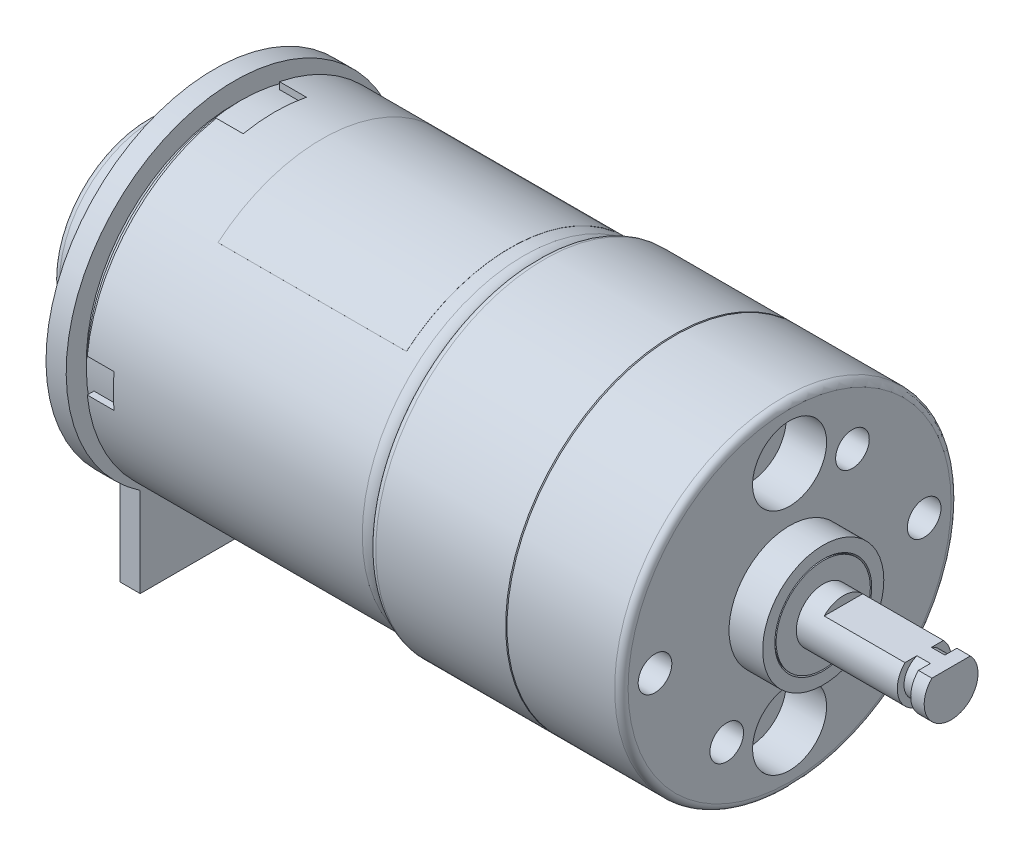
from build123d import *

# Parameters (mm, degrees)
ESQUISSE3_W                = 4.7
ESQUISSE3_H                = 3
ESQUISSE3_W_2              = 3
ESQUISSE3_H_2              = 2.5
ENL_V_MAT_EXTRU_1_DEPTH    = 2
CHANFREIN1_SIZE            = 0.5
ESQUISSE5_R                = 1.25
BOSS_EXTRU_1_DEPTH         = 1.5
BOSS_EXTRU_2_START         = 10.25
ESQUISSE6_R                = 12.5
BOSS_EXTRU_2_DEPTH         = 10.25
CONG_2_R                   = 0.5
CHANFREIN2_SIZE            = 0.1
BOSS_EXTRU_3_START         = 8.5
ESQUISSE7_R                = 12.5
BOSS_EXTRU_3_DEPTH         = 8.5
CONG_3_R                   = 0.5
ESQUISSE8_R                = 4.5
ESQUISSE8_R_2              = 3.5
BOSS_EXTRU_4_DEPTH         = 2.5
CHANFREIN3_SIZE            = 0.1
ESQUISSE10_R               = 3.5
ESQUISSE10_R_2             = 2
BOSS_EXTRU_6_DEPTH         = 2.5
ESQUISSE13_W               = 11.559263521
ESQUISSE13_H               = 4.088991178
ENL_V_MAT_EXTRU_2_DEPTH    = 8
ESQUISSE14_R               = 1
BOSS_EXTRU_8_DEPTH         = 7.5
ESQUISSE16_R               = 7
ESQUISSE16_R_2             = 3.5
BOSS_EXTRU_9_DEPTH         = 4
CONG_4_R                   = 0.5
BOSS_EXTRU_10_DEPTH        = 0.1
BOSS_EXTRU_10_DEPTH_BACK   = 4.1
ESQUISSE17_R               = 3.5
ESQUISSE17_R_2             = 1.005
ESQUISSE18_R               = 2.75
ENL_V_MAT_EXTRU_3_DEPTH    = 3
TROU_TARAUD_M32_AT_2_COUNT = 2
TROU_TARAUD_M32_AT_2_PITCH = 17
BOSS_EXTRU_11_START        = -14
BOSS_EXTRU_11_DEPTH        = 14


with BuildPart() as part:
    # Esquisse1 → Révol.-Mince3 (revolve)
    with BuildSketch(Plane.XY, mode=Mode.PRIVATE) as r_vol_mince3_sk:
        with BuildLine():
            Line((0, 0), (0, -11))
            ThreePointArc((0, -11), (-0.292893219, -11.707106781), (-1, -12))
            Line((-1, -12), (-21.5, -12))
            Line((-21.5, -12), (-21.5, -11.5))
            Line((-21.5, -11.5), (-1, -11.5))
            ThreePointArc((-1, -11.5), (-0.646446609, -11.353553391), (-0.5, -11))
            Line((-0.5, -11), (-0.5, 0))
            Line((-0.5, 0), (0, 0))
        make_face()
    revolve(r_vol_mince3_sk.sketch.rotate(Axis((-41.566699443, 0, 0), (1, 0, 0)), 270), axis=Axis((-41.566699443, 0, 0), (1, 0, 0)))

    # Esquisse3 → Enlèv. mat.-Extru.1 (cut)
    with BuildSketch(Plane.ZY.offset(21.5)):
        with Locations((0, -11.5)):
            Rectangle(ESQUISSE3_W, ESQUISSE3_H)
        with Locations((0, 11.5)):
            Rectangle(ESQUISSE3_W, ESQUISSE3_H)
        with Locations((11.5, 0)):
            Rectangle(ESQUISSE3_W_2, ESQUISSE3_H_2)
        with Locations((-11.5, 0)):
            Rectangle(ESQUISSE3_W_2, ESQUISSE3_H_2)
    extrude(amount=-ENL_V_MAT_EXTRU_1_DEPTH, mode=Mode.SUBTRACT)

    # Esquisse4 → Révolution2 (revolve)
    with BuildSketch(Plane.XY, mode=Mode.PRIVATE) as r_volution2_sk:
        with BuildLine():
            Line((-0.5, 11), (-0.5, 0))
            Line((-0.5, 0), (-22.5, 0))
            Line((-22.5, 0), (-22.5, 11.5))
            Line((-22.5, 11.5), (-1, 11.5))
            ThreePointArc((-1, 11.5), (-0.646446609, 11.353553391), (-0.5, 11))
        make_face()
    revolve(r_volution2_sk.sketch.rotate(Axis((-25.268401873, 0, 0), (1, 0, 0)), 90), axis=Axis((-25.268401873, 0, 0), (1, 0, 0)))

    # Chanfrein1
    chanfrein1_edges = [part.edges().sort_by_distance(p)[0] for p in [
        (-22.5, 0, -11.5),
    ]]
    chamfer(chanfrein1_edges, length=CHANFREIN1_SIZE)

    # Esquisse5 → Boss.-Extru.1 (add)
    with BuildSketch(Plane.ZY.offset(22.5)):
        with BuildLine():
            Line((-7, -10.356157589), (-7, -17))
            Line((-7, -17), (7, -17))
            Line((7, -17), (7, -10.356157589))
            ThreePointArc((7, -10.356157589), (0, 12.5), (-7, -10.356157589))
        make_face()
        Circle(ESQUISSE5_R, mode=Mode.SUBTRACT)
    extrude(amount=BOSS_EXTRU_1_DEPTH)

    # Esquisse6 → Boss.-Extru.2 (add)
    with BuildSketch(Plane(origin=(0, 0, 0), x_dir=(0, 0, -1), z_dir=(1, 0, 0)).offset(BOSS_EXTRU_2_START)):
        Circle(ESQUISSE6_R)
    extrude(amount=-BOSS_EXTRU_2_DEPTH)

    # Congé2
    cong_2_edges = [part.edges().sort_by_distance(p)[0] for p in [
        (0, 0, 12.5),
    ]]
    fillet(cong_2_edges, radius=CONG_2_R)

    # Chanfrein2
    chanfrein2_edges = [part.edges().sort_by_distance(p)[0] for p in [
        (10.25, 0, 12.5),
    ]]
    chamfer(chanfrein2_edges, length=CHANFREIN2_SIZE)

    # Esquisse7 → Boss.-Extru.3 (add)
    with BuildSketch(Plane(origin=(10.25, 0, 0), x_dir=(0, 0, -1), z_dir=(1, 0, 0)).offset(BOSS_EXTRU_3_START)):
        Circle(ESQUISSE7_R)
    extrude(amount=-BOSS_EXTRU_3_DEPTH)

    # Congé3
    cong_3_edges = [part.edges().sort_by_distance(p)[0] for p in [
        (18.75, 0, 12.5),
    ]]
    fillet(cong_3_edges, radius=CONG_3_R)

    # Esquisse8 → Boss.-Extru.4 (add)
    with BuildSketch(Plane(origin=(18.75, 0, 0), x_dir=(0, 0, -1), z_dir=(1, 0, 0))):
        Circle(ESQUISSE8_R)
        Circle(ESQUISSE8_R_2, mode=Mode.SUBTRACT)
    extrude(amount=BOSS_EXTRU_4_DEPTH)

    # Chanfrein3
    chanfrein3_edges = [part.edges().sort_by_distance(p)[0] for p in [
        (21.25, 0, 3.5),
    ]]
    chamfer(chanfrein3_edges, length=CHANFREIN3_SIZE)

    # Esquisse10 → Boss.-Extru.6 (add)
    with BuildSketch(Plane(origin=(18.75, 0, 0), x_dir=(0, 0, -1), z_dir=(1, 0, 0))):
        Circle(ESQUISSE10_R)
        Circle(ESQUISSE10_R_2, mode=Mode.SUBTRACT)
    extrude(amount=BOSS_EXTRU_6_DEPTH)

    # Esquisse12 → Révolution3 (revolve)
    with BuildSketch(Plane.XY, mode=Mode.PRIVATE) as r_volution3_sk:
        Polygon((18.75, -2), (28.75, -2), (28.75, -1.5), (29.75, -1.5), (29.75, -2), (30.75, -2), (30.75, 0), (18.75, 0), align=None)
    revolve(r_volution3_sk.sketch.rotate(Axis((-4.872202699, 0, 0), (1, 0, 0)), 270), axis=Axis((-4.872202699, 0, 0), (1, 0, 0)))

    # Esquisse13 → Enlèv. mat.-Extru.2 (cut)
    with BuildSketch(Plane(origin=(30.75, 0, 0), x_dir=(0, 0, -1), z_dir=(1, 0, 0))):
        with Locations((0.530782509, 3.444495589)):
            Rectangle(ESQUISSE13_W, ESQUISSE13_H)
    extrude(amount=-ENL_V_MAT_EXTRU_2_DEPTH, mode=Mode.SUBTRACT)

    # Esquisse14 → Boss.-Extru.8 (add)
    with BuildSketch(Plane.ZY.offset(22.5)):
        with Locations(Location((0, 0, 0), (0, 0, 180))):
            Circle(ESQUISSE14_R)
    extrude(amount=BOSS_EXTRU_8_DEPTH)

    # Esquisse18 → Enlèv. mat.-Extru.3 (cut)
    with BuildSketch(Plane(origin=(18.75, 0, 0), x_dir=(0, 0, -1), z_dir=(1, 0, 0))):
        with Locations((0, 8.5)):
            Circle(ESQUISSE18_R)
        with Locations(Location((0, -8.5, 0), (0, 0, 180))):
            Circle(ESQUISSE18_R)
    extrude(amount=-ENL_V_MAT_EXTRU_3_DEPTH, mode=Mode.SUBTRACT)

    # Esquisse19 → Trou taraudé M31 (revolve, cut)
    with BuildSketch(Plane(origin=(18.75, 0, 10), x_dir=(0, 0, -1), z_dir=(0, 1, 0))):
        Polygon((0, 0), (0, 9.251075774), (1.25, 8.5), (1.25, 0), align=None)
    trou_taraud_m31 = revolve(axis=Axis((25.1, 0, 10), (-1, 0, 0)), mode=Mode.SUBTRACT)

    # Symétrie1: Trou taraudé M31 across plane
    add(trou_taraud_m31.mirror(Plane.XY), mode=Mode.SUBTRACT)

    # Esquisse24 → Trou taraudé M32 (revolve, cut)
    with BuildSketch(Plane(origin=(18.75, 7.101918123, -4.670413149), x_dir=(0, 0, -1), z_dir=(0, 1, 0))):
        Polygon((0, 0), (0, 9.251075774), (1.25, 8.5), (1.25, 0), align=None)
    trou_taraud_m32 = revolve(axis=Axis((25.1, 7.101918123, -4.670413149), (-1, 0, 0)), mode=Mode.SUBTRACT)

    # Trou taraudé M32 at 2: Trou taraudé M32 ×2
    with Locations(*[Vector(0, -0.8355197791354613, 0.549460370430325) * (i * TROU_TARAUD_M32_AT_2_PITCH) for i in range(1, TROU_TARAUD_M32_AT_2_COUNT)]):
        add(trou_taraud_m32, mode=Mode.SUBTRACT)

    # Esquisse25 → Boss.-Extru.11 (add)
    with BuildSketch(Plane(origin=(-2, 0, 0), x_dir=(0, 0, -1), z_dir=(1, 0, 0)).offset(BOSS_EXTRU_11_START)):
        with BuildLine():
            Line((7.713451316, 9.192533317), (7.719879192, 9.200193762))
            ThreePointArc((7.719879192, 9.200193762), (0, 12.01), (-7.719879192, 9.200193762))
            Line((-7.719879192, 9.200193762), (-7.713451316, 9.192533317))
            ThreePointArc((-7.713451316, 9.192533317), (0, 12), (7.713451316, 9.192533317))
        make_face()
    extrude(amount=BOSS_EXTRU_11_DEPTH)


with BuildPart() as body_2:
    # Esquisse16 → Boss.-Extru.9 (new body)
    with BuildSketch(Plane.ZY.offset(29)):
        Circle(ESQUISSE16_R)
        Circle(ESQUISSE16_R_2, mode=Mode.SUBTRACT)
    extrude(amount=-BOSS_EXTRU_9_DEPTH)

    # Congé4
    cong_4_edges = [body_2.edges().sort_by_distance(p)[0] for p in [
        (-29, 0, -7),
        (-25, 0, -7),
    ]]
    fillet(cong_4_edges, radius=CONG_4_R)

    # Esquisse17 → Boss.-Extru.10 (add, two sides: drawn at the far end of the back side and taken through both)
    with BuildSketch(Plane.ZY.offset(29).offset(-BOSS_EXTRU_10_DEPTH_BACK)):
        Circle(ESQUISSE17_R)
        Circle(ESQUISSE17_R_2, mode=Mode.SUBTRACT)
    extrude(amount=BOSS_EXTRU_10_DEPTH + BOSS_EXTRU_10_DEPTH_BACK)


solid = Compound([part.part, body_2.part])
